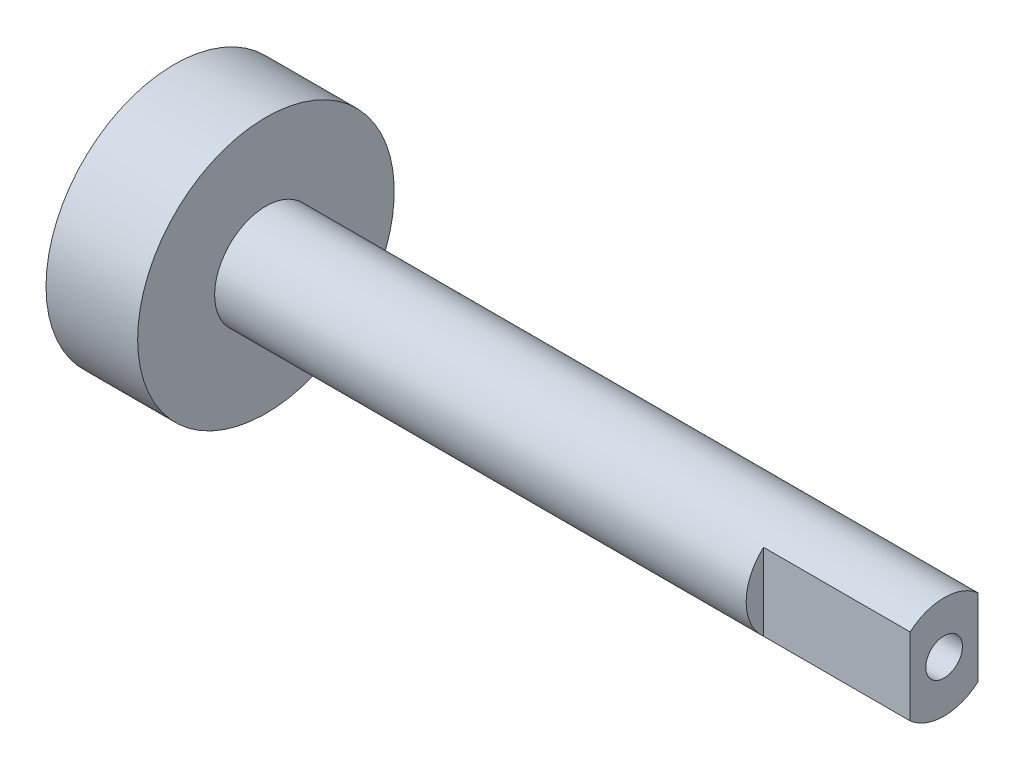
from build123d import *

# Parameters (mm, degrees)
SKETCH1_R           = 2.8
BOSS_EXTRUDE1_DEPTH = 18.5
CUT_EXTRUDE1_DEPTH  = 8
SKETCH3_R           = 1
CUT_EXTRUDE2_DEPTH  = 6
SKETCH5_R           = 7
BOSS_EXTRUDE2_DEPTH = 5


with BuildPart() as part:
    # Sketch1 → Boss-Extrude1 (new, symmetric)
    with BuildSketch(Plane(origin=(0, 0, 0), x_dir=(0, 0, -1), z_dir=(1, 0, 0))):
        Circle(SKETCH1_R)
    extrude(amount=BOSS_EXTRUDE1_DEPTH, both=True)

    # Sketch2 → Cut-Extrude1 (cut)
    with BuildSketch(Plane(origin=(18.5, 0, 0), x_dir=(0, 0, -1), z_dir=(1, 0, 0))):
        with BuildLine():
            Line((-1.85, 2.101784956), (-1.85, -2.101784956))
            ThreePointArc((-1.85, -2.101784956), (-2.8, 0), (-1.85, 2.101784956))
        make_face()
        with BuildLine():
            Line((1.85, 2.101784956), (1.85, -2.101784956))
            ThreePointArc((1.85, -2.101784956), (2.8, 0), (1.85, 2.101784956))
        make_face()
    extrude(amount=-CUT_EXTRUDE1_DEPTH, mode=Mode.SUBTRACT)

    # Sketch3 → Cut-Extrude2 (cut)
    with BuildSketch(Plane(origin=(18.5, 0, 0), x_dir=(0, 0, -1), z_dir=(1, 0, 0))):
        Circle(SKETCH3_R)
    extrude(amount=-CUT_EXTRUDE2_DEPTH, mode=Mode.SUBTRACT)

    # Sketch5 → Boss-Extrude2 (add)
    with BuildSketch(Plane.ZY.offset(18.5)):
        Circle(SKETCH5_R)
    extrude(amount=BOSS_EXTRUDE2_DEPTH)


solid = part.part
